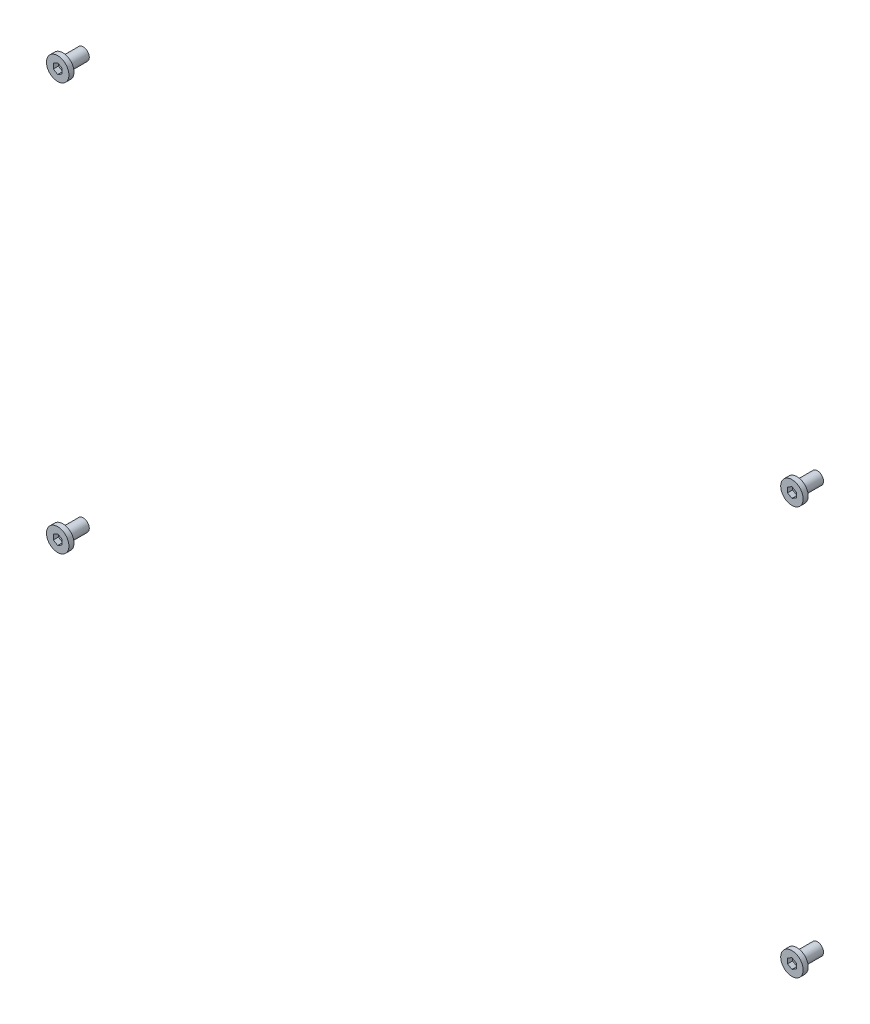
from build123d import *

# Parameters (mm, degrees)
SKETCH_1_R          = 0.6
EXTRUDE_1_DEPTH     = 2
EXTRUDE_1_2_DEPTH   = 2
EXTRUDE_1_3_DEPTH   = 2
EXTRUDE_1_4_DEPTH   = 2
SKETCH_2_R          = 1.1
EXTRUDE_2_DEPTH     = 0.5
CUT_EXTRUDE_1_DEPTH = 0.5


with BuildPart() as part:
    # Эскиз1 → Бобышка-Вытянуть1 (new body)
    with BuildSketch(Plane.XY):
        with Locations((-36, 20)):
            Circle(SKETCH_1_R)
    extrude(amount=EXTRUDE_1_DEPTH)



with BuildPart() as body_2:
    # Эскиз1 → Extrude 1 2 (new body)
    with BuildSketch(Plane.XY):
        with Locations((36, 20)):
            Circle(SKETCH_1_R)
    extrude(amount=EXTRUDE_1_2_DEPTH)


with BuildPart() as body_3:
    # Эскиз1 → Extrude 1 3 (new body)
    with BuildSketch(Plane.XY):
        with Locations((36, -20)):
            Circle(SKETCH_1_R)
    extrude(amount=EXTRUDE_1_3_DEPTH)


with BuildPart() as body_4:
    # Эскиз1 → Extrude 1 4 (new body)
    with BuildSketch(Plane.XY):
        with Locations((-36, -20)):
            Circle(SKETCH_1_R)
    extrude(amount=EXTRUDE_1_4_DEPTH)


with BuildPart() as part_1:
    add(part.part)

    add(body_2.part)  # Бобышка-Вытянуть2 merges body 2

    add(body_3.part)  # Бобышка-Вытянуть2 merges body 3

    add(body_4.part)  # Бобышка-Вытянуть2 merges body 4
    # Эскиз2 → Бобышка-Вытянуть2 (add)
    with BuildSketch(Plane.XY.offset(2)):
        with Locations((-36, 20)):
            Circle(SKETCH_2_R)
        with Locations((36, 20)):
            Circle(SKETCH_2_R)
        with Locations((36, -20)):
            Circle(SKETCH_2_R)
        with Locations((-36, -20)):
            Circle(SKETCH_2_R)
    extrude(amount=EXTRUDE_2_DEPTH)

    # Эскиз3 → Вырез-Вытянуть1 (cut)
    with BuildSketch(Plane.XY.offset(2.5)):
        Polygon((36.433012702, -20.25), (36.433012702, -19.75), (36, -19.5), (35.566987298, -19.75), (35.566987298, -20.25), (36, -20.5), align=None)
        Polygon((36.433012702, 19.75), (36.433012702, 20.25), (36, 20.5), (35.566987298, 20.25), (35.566987298, 19.75), (36, 19.5), align=None)
        Polygon((-35.566987298, 19.75), (-35.566987298, 20.25), (-36, 20.5), (-36.433012702, 20.25), (-36.433012702, 19.75), (-36, 19.5), align=None)
        Polygon((-35.566987298, -20.25), (-35.566987298, -19.75), (-36, -19.5), (-36.433012702, -19.75), (-36.433012702, -20.25), (-36, -20.5), align=None)
    extrude(amount=-CUT_EXTRUDE_1_DEPTH, mode=Mode.SUBTRACT)


solid = part_1.part
